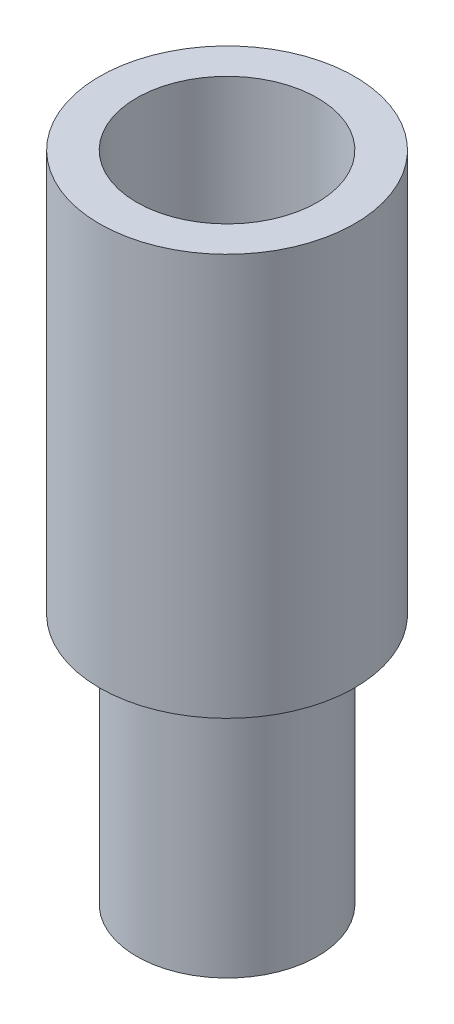
from build123d import *

# Parameters (mm, degrees)
SKETCH1_R           = 12.7
BOSS_EXTRUDE1_DEPTH = 15
SKETCH2_R           = 9
BOSS_EXTRUDE2_DEPTH = 25
SKETCH3_R           = 12.7
SKETCH3_R_2         = 9
BOSS_EXTRUDE3_DEPTH = 25


with BuildPart() as part:
    # Sketch1 → Boss-Extrude1 (new body)
    with BuildSketch(Plane(origin=(0, 0, 0), x_dir=(1, 0, 0), z_dir=(0, 1, 0))):
        with Locations(Location((0, 0, 0), (0, 0, 270))):
            Circle(SKETCH1_R)
    extrude(amount=BOSS_EXTRUDE1_DEPTH)

    # Sketch2 → Boss-Extrude2 (add)
    with BuildSketch(Plane.XZ):
        with Locations(Location((0, 0, 0), (0, 0, 270))):
            Circle(SKETCH2_R)
    extrude(amount=BOSS_EXTRUDE2_DEPTH)

    # Sketch3 → Boss-Extrude3 (add)
    with BuildSketch(Plane(origin=(0, 15, 0), x_dir=(1, 0, 0), z_dir=(0, 1, 0))):
        with Locations(Location((0, 0, 0), (0, 0, 270))):
            Circle(SKETCH3_R)
        with Locations(Location((0, 0, 0), (0, 0, 90))):
            Circle(SKETCH3_R_2, mode=Mode.SUBTRACT)
    extrude(amount=BOSS_EXTRUDE3_DEPTH)


solid = part.part
